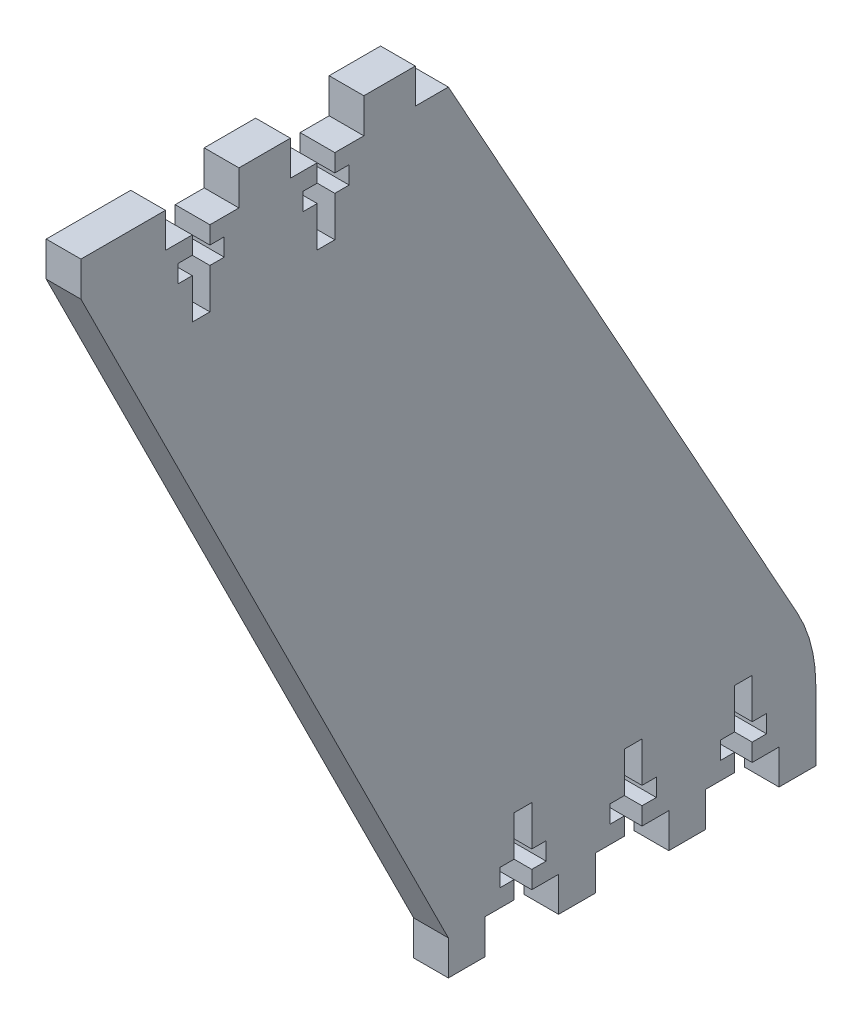
from build123d import *

# Parameters (mm, degrees)
BOSS_EXTRUDE1_DEPTH = 6


with BuildPart() as part:
    # Sketch1 → Boss-Extrude1 (new body)
    with BuildSketch(Plane(origin=(0, 0, 0), x_dir=(0, 0, -1), z_dir=(1, 0, 0))):
        with BuildLine():
            Line((-95.25, 127.35), (-31.75, 0))
            Line((-31.75, 0), (-31.75, -6))
            Line((-31.75, -6), (-25.4, -6))
            Line((-25.4, -6), (-25.4, 0))
            Line((-25.4, 0), (-20.3835, 0))
            Line((-20.3835, 0), (-20.3835, 3.048))
            Line((-20.3835, 3.048), (-22.86, 3.048))
            Line((-22.86, 3.048), (-22.86, 6.096))
            Line((-22.86, 6.096), (-20.3835, 6.096))
            Line((-20.3835, 6.096), (-20.3835, 13.050000062))
            Line((-20.3835, 13.050000062), (-17.3355, 13.050000062))
            Line((-17.3355, 13.050000062), (-17.3355, 6.096))
            Line((-17.3355, 6.096), (-14.859, 6.096))
            Line((-14.859, 6.096), (-14.859, 3.048))
            Line((-14.859, 3.048), (-17.3355, 3.048))
            Line((-17.3355, 3.048), (-17.3355, 0))
            Line((-17.3355, 0), (-12.7, 0))
            Line((-12.7, 0), (-12.7, -6))
            Line((-12.7, -6), (-6.35, -6))
            Line((-6.35, -6), (-6.35, 0))
            Line((-6.35, 0), (-1.3335, 0))
            Line((-1.3335, 0), (-1.3335, 3.048))
            Line((-1.3335, 3.048), (-3.81, 3.048))
            Line((-3.81, 3.048), (-3.81, 6.096))
            Line((-3.81, 6.096), (-1.3335, 6.096))
            Line((-1.3335, 6.096), (-1.3335, 13.050000062))
            Line((-1.3335, 13.050000062), (1.7145, 13.050000062))
            Line((1.7145, 13.050000062), (1.7145, 6.096))
            Line((1.7145, 6.096), (4.191, 6.096))
            Line((4.191, 6.096), (4.191, 3.048))
            Line((4.191, 3.048), (1.7145, 3.048))
            Line((1.7145, 3.048), (1.7145, 0))
            Line((1.7145, 0), (6.35, 0))
            Line((6.35, 0), (6.35, -6))
            Line((6.35, -6), (12.7, -6))
            Line((12.7, -6), (12.7, 0))
            Line((12.7, 0), (17.7165, 0))
            Line((17.7165, 0), (17.7165, 3.048))
            Line((17.7165, 3.048), (15.24, 3.048))
            Line((15.24, 3.048), (15.24, 6.096))
            Line((15.24, 6.096), (17.7165, 6.096))
            Line((17.7165, 6.096), (17.7165, 13.050000062))
            Line((17.7165, 13.050000062), (20.7645, 13.050000062))
            Line((20.7645, 13.050000062), (20.7645, 6.096))
            Line((20.7645, 6.096), (23.241, 6.096))
            Line((23.241, 6.096), (23.241, 3.048))
            Line((23.241, 3.048), (20.7645, 3.048))
            Line((20.7645, 3.048), (20.7645, 0))
            Line((20.7645, 0), (25.4, 0))
            Line((25.4, 0), (25.4, -6))
            Line((25.4, -6), (31.75, -6))
            Line((31.75, -6), (31.75, 0))
            Line((31.75, 0), (31.75, 6.135772776))
            ThreePointArc((31.75, 6.135772776), (30.94204324, 12.491196387), (28.569574073, 18.442296576))
            Line((28.569574073, 18.442296576), (-31.75, 127.35))
            Line((-31.75, 127.35), (-37.465, 127.35))
            Line((-37.465, 127.35), (-37.465, 133.35))
            Line((-37.465, 133.35), (-46.355, 133.35))
            Line((-46.355, 133.35), (-46.355, 127.35))
            Line((-46.355, 127.35), (-51.3715, 127.35))
            Line((-51.3715, 127.35), (-51.3715, 124.302))
            Line((-51.3715, 124.302), (-48.895, 124.302))
            Line((-48.895, 124.302), (-48.895, 121.254))
            Line((-48.895, 121.254), (-51.3715, 121.254))
            Line((-51.3715, 121.254), (-51.3715, 114.299999938))
            Line((-51.3715, 114.299999938), (-54.4195, 114.299999938))
            Line((-54.4195, 114.299999938), (-54.4195, 121.254))
            Line((-54.4195, 121.254), (-56.896, 121.254))
            Line((-56.896, 121.254), (-56.896, 124.302))
            Line((-56.896, 124.302), (-54.4195, 124.302))
            Line((-54.4195, 124.302), (-54.4195, 127.35))
            Line((-54.4195, 127.35), (-59.055, 127.35))
            Line((-59.055, 127.35), (-59.055, 133.35))
            Line((-59.055, 133.35), (-67.945, 133.35))
            Line((-67.945, 133.35), (-67.945, 127.35))
            Line((-67.945, 127.35), (-72.9615, 127.35))
            Line((-72.9615, 127.35), (-72.9615, 124.302))
            Line((-72.9615, 124.302), (-70.485, 124.302))
            Line((-70.485, 124.302), (-70.485, 121.254))
            Line((-70.485, 121.254), (-72.9615, 121.254))
            Line((-72.9615, 121.254), (-72.9615, 114.299999938))
            Line((-72.9615, 114.299999938), (-76.0095, 114.299999938))
            Line((-76.0095, 114.299999938), (-76.0095, 121.254))
            Line((-76.0095, 121.254), (-78.486, 121.254))
            Line((-78.486, 121.254), (-78.486, 124.302))
            Line((-78.486, 124.302), (-76.0095, 124.302))
            Line((-76.0095, 124.302), (-76.0095, 127.35))
            Line((-76.0095, 127.35), (-80.645, 127.35))
            Line((-80.645, 127.35), (-80.645, 133.35))
            Line((-80.645, 133.35), (-95.25, 133.35))
            Line((-95.25, 133.35), (-95.25, 127.35))
        make_face()
    extrude(amount=BOSS_EXTRUDE1_DEPTH)


solid = part.part
